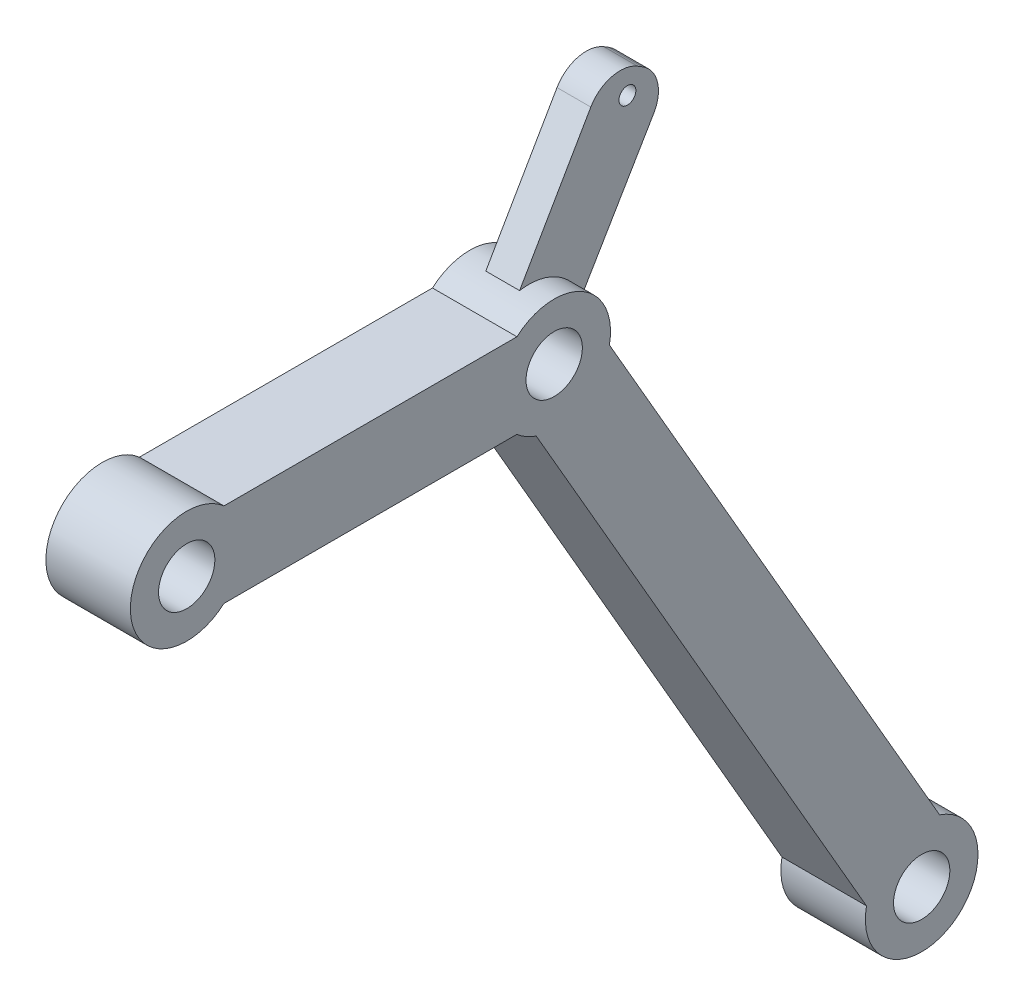
from build123d import *

# Parameters (mm, degrees)
SKETCH7_W           = 30
SKETCH7_H           = 30
SKETCH7_W_2         = 25
SKETCH7_H_2         = 25
SKETCH8_R           = 20
BOSS_EXTRUDE1_DEPTH = 30
SKETCH9_R           = 10
CUT_EXTRUDE1_DEPTH  = 30
SKETCH13_R          = 3
BOSS_EXTRUDE2_DEPTH = 6


with BuildPart() as part:
    # Sweep4: sweep along a path in Sketch2
    with BuildLine(Plane(origin=(0, 0, 0), x_dir=(0, 0, -1), z_dir=(1, 0, 0))) as sweep4_path:
        Line((-130.5, 0), (0, 0))
        Line((0, 0), (130.5, -226.032630388))
    # Sketch7 → Sweep4 (sweep)
    with BuildSketch(Plane.XY.offset(130.5)):
        Rectangle(SKETCH7_W, SKETCH7_H)
        Rectangle(SKETCH7_W_2, SKETCH7_H_2, mode=Mode.SUBTRACT)
    sweep(path=sweep4_path.line, transition=Transition.RIGHT)

    # Sketch8 → Boss-Extrude1 (add)
    with BuildSketch(Plane(origin=(15, 0, 0), x_dir=(0, 0, -1), z_dir=(1, 0, 0))):
        Circle(SKETCH8_R)
        with Locations((-130.5, 0)):
            Circle(SKETCH8_R)
        with Locations((130.5, -226.032630388)):
            Circle(SKETCH8_R)
    extrude(amount=-BOSS_EXTRUDE1_DEPTH)

    # Sketch9 → Cut-Extrude1 (cut)
    with BuildSketch(Plane(origin=(15, 0, 0), x_dir=(0, 0, -1), z_dir=(1, 0, 0))):
        with Locations(Location((0, 0, 0), (0, 0, 90))):
            Circle(SKETCH9_R)
        with Locations(Location((-130.5, 0, 0), (0, 0, 90))):
            Circle(SKETCH9_R)
        with Locations(Location((130.5, -226.032630388, 0), (0, 0, 90))):
            Circle(SKETCH9_R)
    extrude(amount=-CUT_EXTRUDE1_DEPTH, mode=Mode.SUBTRACT)

    # Sketch13 → Boss-Extrude2 (add, symmetric)
    with BuildSketch(Plane(origin=(0, 0, 0), x_dir=(0, 0, -1), z_dir=(1, 0, 0))):
        with BuildLine():
            Line((19.604759334, -3.956439237), (9.859578521, 1.669943529))
            ThreePointArc((9.859578521, 1.669943529), (5, 8.660254038), (-3.483575742, 9.373617234))
            Line((-3.483575742, 9.373617234), (-13.228756555, 15))
            ThreePointArc((-13.228756555, 15), (-8.58962126, 18.061517284), (-3.287056594, 19.728032313))
            Line((-3.287056594, 19.728032313), (22.000269373, 63.526965676))
            ThreePointArc((22.000269373, 63.526965676), (29.427887497, 69.154976368), (38.643459087, 67.770326373))
            Line((38.643459087, 67.770326373), (40.285678743, 66.768182028))
            ThreePointArc((40.285678743, 66.768182028), (45.677401844, 59.431654602), (44.366919196, 50.421774031))
            Line((44.366919196, 50.421774031), (18.728505447, 7.017341642))
            ThreePointArc((18.728505447, 7.017341642), (19.936543429, 1.591928422), (19.604759334, -3.956439237))
        make_face()
        with Locations((35, 60.621778265)):
            Circle(SKETCH13_R, mode=Mode.SUBTRACT)
    extrude(amount=BOSS_EXTRUDE2_DEPTH, both=True)


solid = part.part
